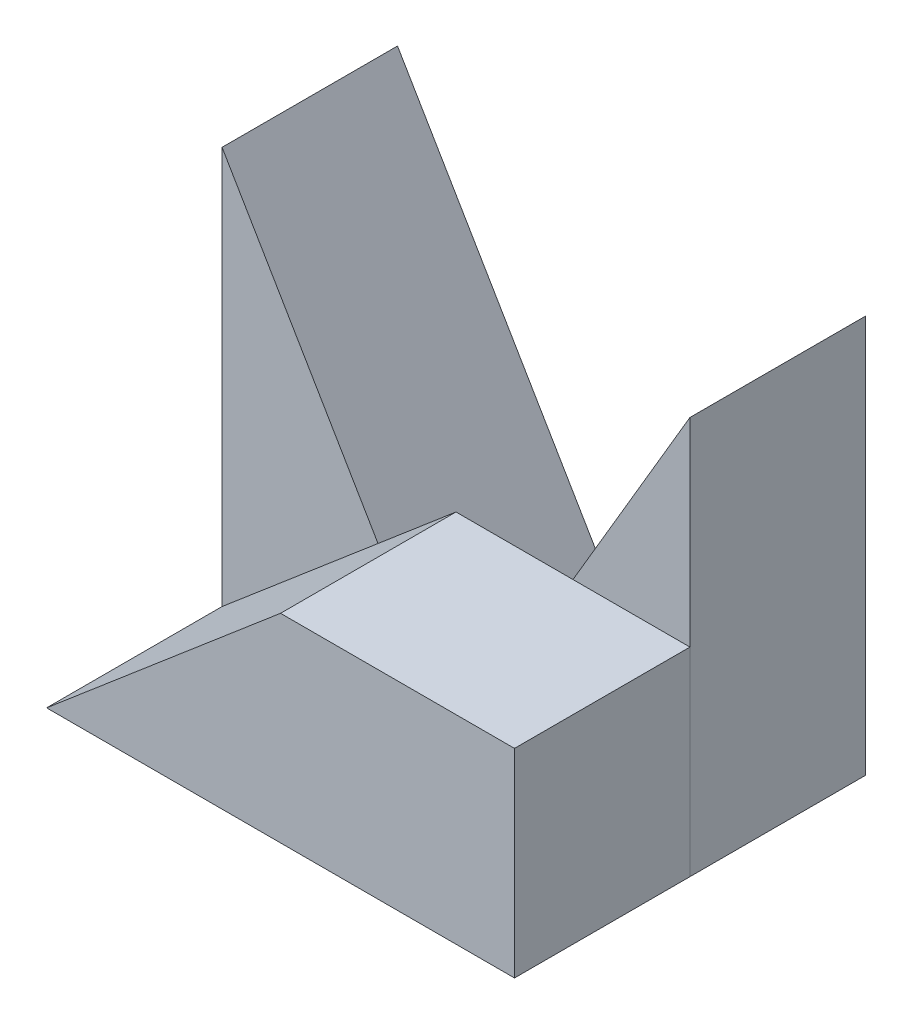
from build123d import *

# Parameters (mm, degrees)
BOSS_EXTRUDE1_DEPTH  = 15000
BOSS_EXTRUDE2_DEPTH  = 15000
BOSS_EXTRUDE16_DEPTH = 15000


with BuildPart() as part:
    # Sketch1 → Boss-Extrude1 (new body)
    with BuildSketch(Plane.XY):
        Polygon((-20285.714285714, 0), (19714.285714286, 0), (19714.285714286, 17000), (-285.714285714, 17000), align=None)
    extrude(amount=-BOSS_EXTRUDE1_DEPTH)

    # Sketch2 → Boss-Extrude2 (add)
    with BuildSketch(Plane(origin=(0, 0, -15000), x_dir=(-1, 0, 0), z_dir=(0, 0, -1))):
        Polygon((285.714285714, 0), (20285.714285714, 0), (20285.714285714, 34000), align=None)
    extrude(amount=BOSS_EXTRUDE2_DEPTH)


with BuildPart() as body_2:
    # Sketch5 → Boss-Extrude16 (new body)
    with BuildSketch(Plane(origin=(0, 0, -15000), x_dir=(-1, 0, 0), z_dir=(0, 0, -1))):
        Polygon((-19714.285714286, 17000), (-9714.285714286, 17000), (-19714.285714286, 34000), align=None)
        Polygon((-19714.285714286, 0), (285.714285714, 0), (-9714.285714286, 17000), (-19714.285714286, 17000), align=None)
    extrude(amount=BOSS_EXTRUDE16_DEPTH)


solid = Compound([part.part, body_2.part])
